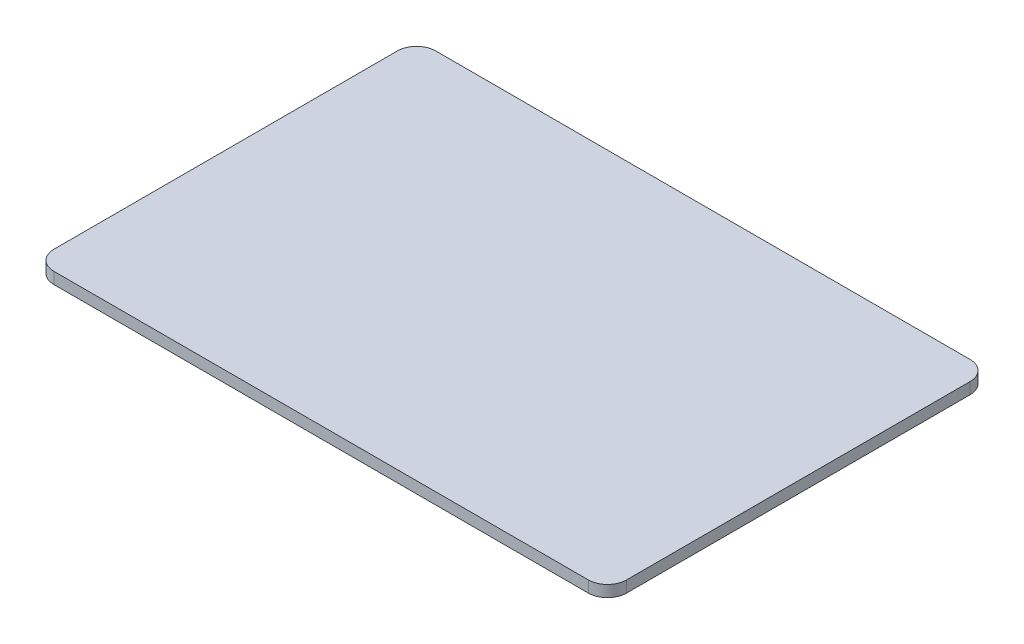
from build123d import *

# Parameters (mm, degrees)
BOSS_EXTRUDE1_DEPTH      = 2.54
BOSS_EXTRUDE1_DEPTH_BACK = 1.27
SKETCH1_W                = 190.5
SKETCH1_H                = 127
FILLET1_R                = 6.35


with BuildPart() as part:
    # Sketch1 → Boss-Extrude1 (new, two sides: drawn at the far end of the back side and taken through both)
    with BuildSketch(Plane(origin=(0, 0, 0), x_dir=(1, 0, 0), z_dir=(0, 1, 0)).offset(-BOSS_EXTRUDE1_DEPTH_BACK)):
        Rectangle(SKETCH1_W, SKETCH1_H)
    extrude(amount=BOSS_EXTRUDE1_DEPTH + BOSS_EXTRUDE1_DEPTH_BACK)

    # Fillet1
    fillet1_edges = [part.edges().sort_by_distance(p)[0] for p in [
        (95.25, 0.635, 63.5),
        (-95.25, 0.635, 63.5),
        (-95.25, 0.635, -63.5),
        (95.25, 0.635, -63.5),
    ]]
    fillet(fillet1_edges, radius=FILLET1_R)


solid = part.part
